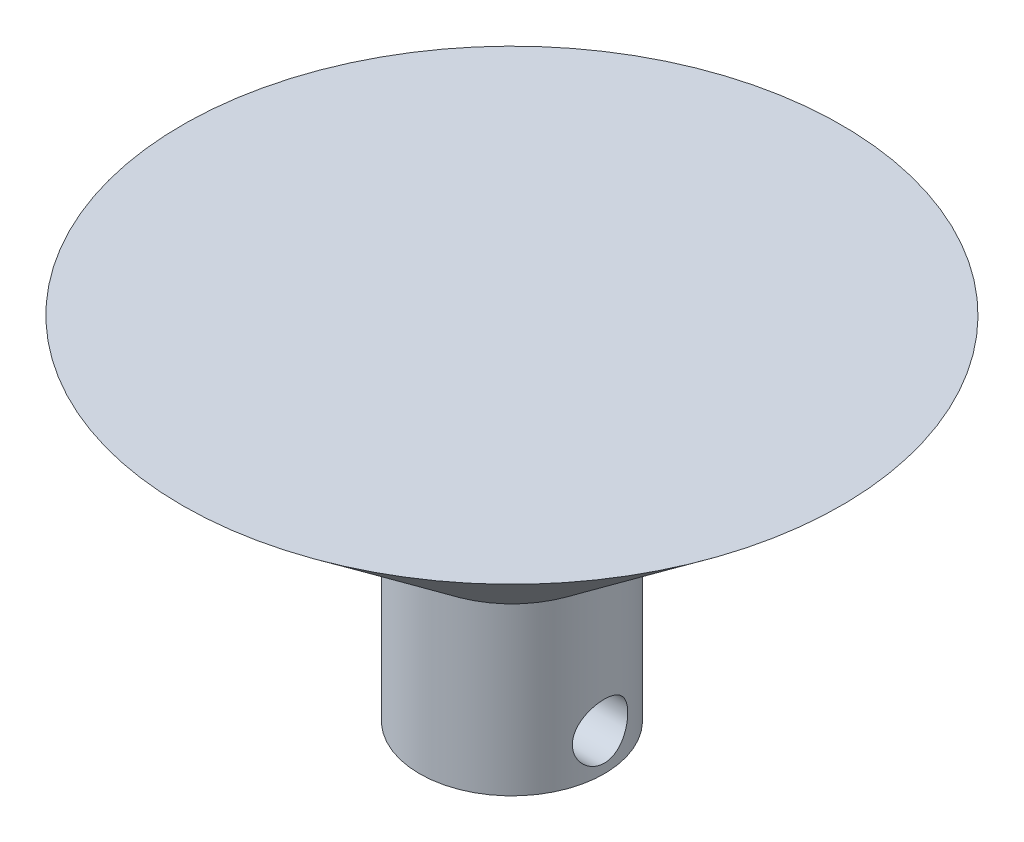
from build123d import *

# Parameters (mm, degrees)
SKETCH1_R             = 5
BODY_DEPTH            = 9
PIN_INSERT_DEPTH      = 12.445523142
PIN_INSERT_DEPTH_BACK = 12.445523142
SKETCH2_R             = 1.5
HEAD_SA_R             = 17.841


with BuildPart() as part:
    # Sketch1 → body (new body)
    with BuildSketch(Plane(origin=(0, 0, 0), x_dir=(1, 0, 0), z_dir=(0, 1, 0))):
        with Locations(Location((0, 0, 0), (0, 0, 270))):
            Circle(SKETCH1_R)
    extrude(amount=BODY_DEPTH)

    # Sketch2 → pin insert (cut, two sides: drawn at the far end of the back side and taken through both)
    with BuildSketch(Plane(origin=(0, 0, 0), x_dir=(0, 0, -1), z_dir=(1, 0, 0)).offset(-PIN_INSERT_DEPTH_BACK)):
        with Locations((0, 2)):
            Circle(SKETCH2_R)
    extrude(amount=PIN_INSERT_DEPTH + PIN_INSERT_DEPTH_BACK, mode=Mode.SUBTRACT)

    # head SA → section 0 of cone
    with BuildSketch(Plane(origin=(0, 19, 0), x_dir=(1, 0, 0), z_dir=(0, 1, 0)), mode=Mode.PRIVATE) as cone_s0:
        Circle(HEAD_SA_R)
    # loft up to a face of the part (cone)
    loft([cone_s0.sketch, part.faces().sort_by_distance((0, 9, 0))[0]])


solid = part.part
